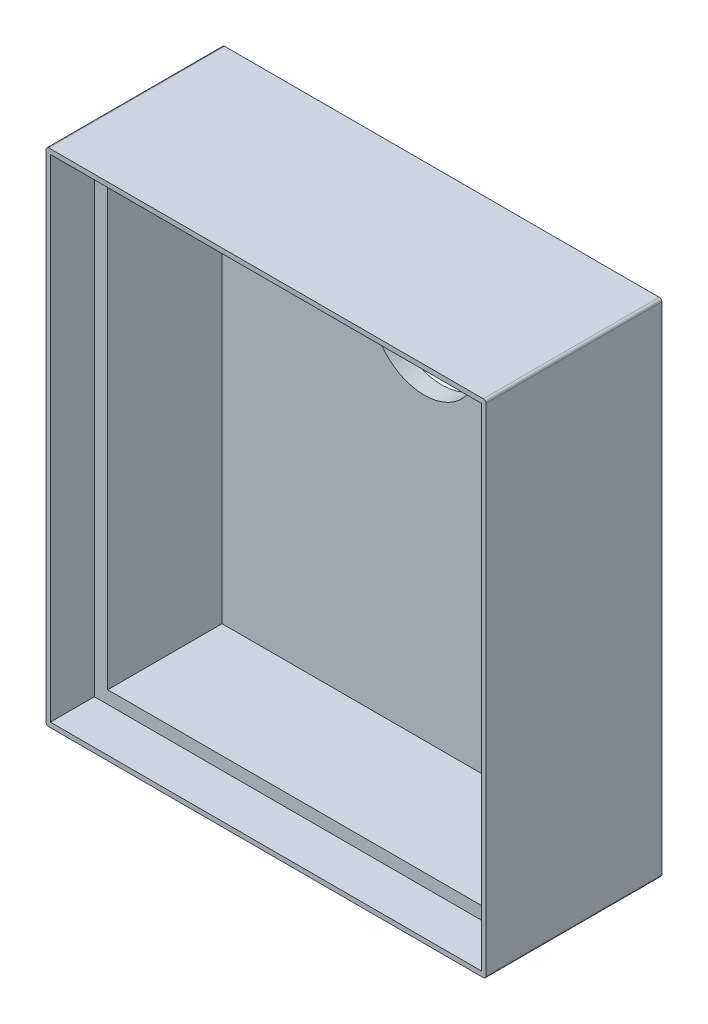
from build123d import *

# Parameters (mm, degrees)
EXTRUDE_1_DEPTH     = 200
SHELL_1_T           = -20
CUT_EXTRUDE_1_DEPTH = 50
SKETCH_3_R          = 60
CUT_EXTRUDE_2_DEPTH = 50


with BuildPart() as part:
    # 草图1 → 凸台-拉伸1 (new body)
    with BuildSketch(Plane.XY):
        with BuildLine():
            Line((3, 0), (497, 0))
            ThreePointArc((497, 0), (499.121320344, -0.878679656), (500, -3))
            Line((500, -3), (500, -567))
            ThreePointArc((500, -567), (499.121320344, -569.121320344), (497, -570))
            Line((497, -570), (3, -570))
            ThreePointArc((3, -570), (0.878679656, -569.121320344), (0, -567))
            Line((0, -567), (0, -3))
            ThreePointArc((0, -3), (0.878679656, -0.878679656), (3, 0))
        make_face()
    extrude(amount=EXTRUDE_1_DEPTH)

    # 抽壳1
    shell_1_openings = [part.faces().sort_by_distance(p)[0] for p in [
        (250, -285, 200),
    ]]
    offset(amount=SHELL_1_T, openings=shell_1_openings, kind=Kind.INTERSECTION)

    # 草图2 → 切除-拉伸1 (cut)
    with BuildSketch(Plane.XY.offset(200)):
        Polygon((4.785, -5.49), (495.215, -5.49), (495.215, -20), (495.215, -550), (495.215, -564.51), (4.785, -564.51), (4.785, -550), (4.785, -20), align=None)
    extrude(amount=-CUT_EXTRUDE_1_DEPTH, mode=Mode.SUBTRACT)

    # 草图3 → 切除-拉伸2 (cut)
    with BuildSketch(Plane(origin=(0, 0, 0), x_dir=(-1, 0, 0), z_dir=(0, 0, -1))):
        with Locations((-250, -150)):
            Circle(SKETCH_3_R)
    extrude(amount=-CUT_EXTRUDE_2_DEPTH, mode=Mode.SUBTRACT)


solid = part.part
